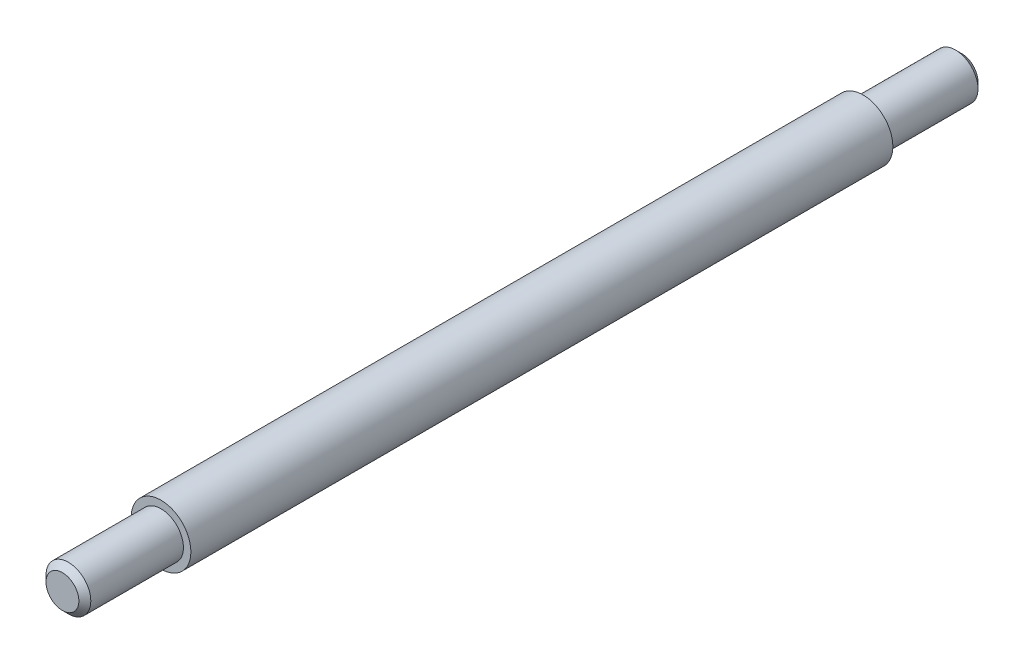
from build123d import *

# Parameters (mm, degrees)
SKETCH1_R           = 2
BOSS_EXTRUDE1_DEPTH = 47
SKETCH2_R           = 1.5
BOSS_EXTRUDE2_DEPTH = 6.6
BOSS_EXTRUDE3_START = 6.6
SKETCH3_R           = 1.5
BOSS_EXTRUDE3_DEPTH = 6.6
CHAMFER1_SIZE       = 0.4


with BuildPart() as part:
    # Sketch1 → Boss-Extrude1 (new body)
    with BuildSketch(Plane.XY):
        Circle(SKETCH1_R)
    extrude(amount=-BOSS_EXTRUDE1_DEPTH)

    # Sketch2 → Boss-Extrude2 (add)
    with BuildSketch(Plane.XY):
        Circle(SKETCH2_R)
    extrude(amount=BOSS_EXTRUDE2_DEPTH)

    # Sketch3 → Boss-Extrude3 (add)
    with BuildSketch(Plane(origin=(0, 0, -47), x_dir=(-1, 0, 0), z_dir=(0, 0, -1)).offset(BOSS_EXTRUDE3_START)):
        with Locations(Location((0, 0, 0), (0, 0, 180))):
            Circle(SKETCH3_R)
    extrude(amount=-BOSS_EXTRUDE3_DEPTH)

    # Chamfer1
    chamfer1_edges = [part.edges().sort_by_distance(p)[0] for p in [
        (-1.5, 0, -53.6),
        (-1.5, 0, 6.6),
    ]]
    chamfer(chamfer1_edges, length=CHAMFER1_SIZE)


solid = part.part
